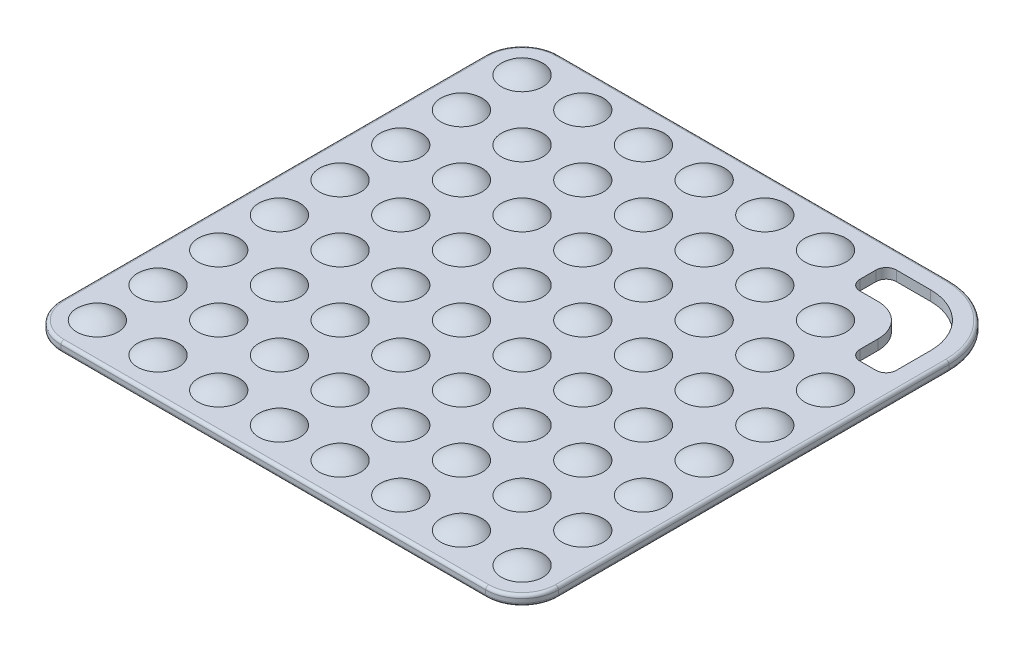
from build123d import *

# Parameters (mm, degrees)
BOSS_EXTRUDE1_DEPTH     = 5
LPATTERN1_COUNT         = 8
LPATTERN1_PITCH         = 30
LPATTERN1_COUNT_DIR2    = 8
LPATTERN1_PITCH_DIR2    = 30
CUT_EXTRUDE1_DEPTH      = 175.180940404
CUT_EXTRUDE1_DEPTH_BACK = 175.180940404
FILLET1_R               = 1.5


with BuildPart() as part:
    # Sketch1 → Boss-Extrude1 (new body)
    with BuildSketch(Plane(origin=(0, 0, 0), x_dir=(1, 0, 0), z_dir=(0, 1, 0))):
        with BuildLine():
            Line((-105, 123), (88, 123))
            ThreePointArc((88, 123), (112.748737342, 112.748737342), (123, 88))
            Line((123, 88), (123, -105))
            ThreePointArc((123, -105), (117.727922061, -117.727922061), (105, -123))
            Line((105, -123), (-105, -123))
            ThreePointArc((-105, -123), (-117.727922061, -117.727922061), (-123, -105))
            Line((-123, -105), (-123, 105))
            ThreePointArc((-123, 105), (-117.727922061, 117.727922061), (-105, 123))
        make_face()
    extrude(amount=BOSS_EXTRUDE1_DEPTH)

    # Sketch3 → Revolve4 (revolve)
    with BuildSketch(Plane.XY.offset(105)):
        with BuildLine():
            Line((105, 5), (115.198039027, 5))
            ThreePointArc((115.198039027, 5), (110.477225575, 7.964240044), (105, 9))
            Line((105, 9), (105, 5))
        make_face()
    revolve4 = revolve(axis=Axis((105, 9, 105), (0, -1, 0)))

    # LPattern1: Revolve4 8 × 8, 3 skipped
    with Locations(*[(-i * LPATTERN1_PITCH, 0, -j * LPATTERN1_PITCH_DIR2) for i in range(LPATTERN1_COUNT) for j in range(LPATTERN1_COUNT_DIR2) if (i, j) not in ((0, 0), (0, 6), (0, 7), (1, 7))]):
        add(revolve4)

    # Sketch4 → Cut-Extrude1 (cut, two sides: drawn at the far end of the back side and taken through both)
    with BuildSketch(Plane(origin=(0, 0, 0), x_dir=(1, 0, 0), z_dir=(0, 1, 0)).offset(-CUT_EXTRUDE1_DEPTH_BACK)):
        with BuildLine():
            Line((88, 114), (71, 114))
            ThreePointArc((71, 114), (67.464466094, 112.535533906), (66, 109))
            Line((66, 109), (66, 101))
            ThreePointArc((66, 101), (67.464466094, 97.464466094), (71, 96))
            Line((71, 96), (80, 96))
            ThreePointArc((80, 96), (91.313708499, 91.313708499), (96, 80))
            Line((96, 80), (96, 71))
            ThreePointArc((96, 71), (97.464466094, 67.464466094), (101, 66))
            Line((101, 66), (109, 66))
            ThreePointArc((109, 66), (112.535533906, 67.464466094), (114, 71))
            Line((114, 71), (114, 88))
            ThreePointArc((114, 88), (106.384776311, 106.384776311), (88, 114))
        make_face()
    extrude(amount=CUT_EXTRUDE1_DEPTH + CUT_EXTRUDE1_DEPTH_BACK, mode=Mode.SUBTRACT)

    # Fillet1
    fillet1_edges = [part.edges().sort_by_distance(p)[0] for p in [
        (-123, 0, 0),
        (-117.727922061, 0, -117.727922061),
        (-8.5, 0, -123),
        (112.748737342, 0, -112.748737342),
        (-117.727922061, 5, -117.727922061),
        (-123, 5, 0),
        (-117.727922061, 5, 117.727922061),
        (0, 5, 123),
        (117.727922061, 5, 117.727922061),
        (123, 5, 8.5),
        (112.748737342, 5, -112.748737342),
        (123, 0, 8.5),
        (-8.5, 5, -123),
        (117.727922061, 0, 117.727922061),
        (0, 0, 123),
        (-117.727922061, 0, 117.727922061),
    ]]
    fillet(fillet1_edges, radius=FILLET1_R)


solid = part.part
